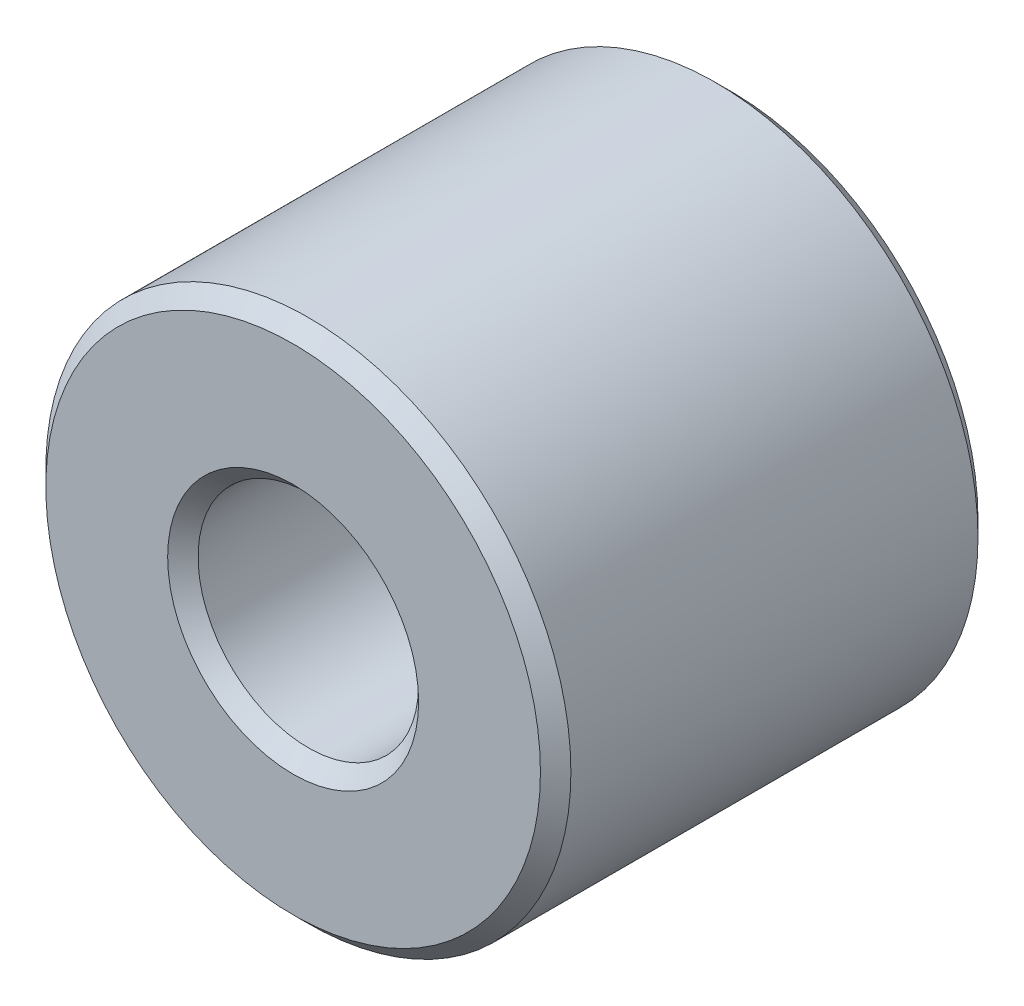
from build123d import *

# Parameters (mm, degrees)
BOSS_EXTRUDE1_DEPTH      = 7.9375
BOSS_EXTRUDE1_DEPTH_BACK = 7.9375
SKETCH3_R                = 9.525
SKETCH3_R_2              = 4.0005
CHAMFER1_SIZE            = 0.55245


with BuildPart() as part:
    # Sketch3 → Boss-Extrude1 (new, two sides: drawn at the far end of the back side and taken through both)
    with BuildSketch(Plane.XY.offset(-BOSS_EXTRUDE1_DEPTH_BACK)):
        Circle(SKETCH3_R)
        Circle(SKETCH3_R_2, mode=Mode.SUBTRACT)
    extrude(amount=BOSS_EXTRUDE1_DEPTH + BOSS_EXTRUDE1_DEPTH_BACK)

    # Chamfer1
    chamfer1_edges = [part.edges().sort_by_distance(p)[0] for p in [
        (-9.525, 0, -7.9375),
        (-4.0005, 0, -7.9375),
        (-9.525, 0, 7.9375),
        (-4.0005, 0, 7.9375),
    ]]
    chamfer(chamfer1_edges, length=CHAMFER1_SIZE)


solid = part.part
